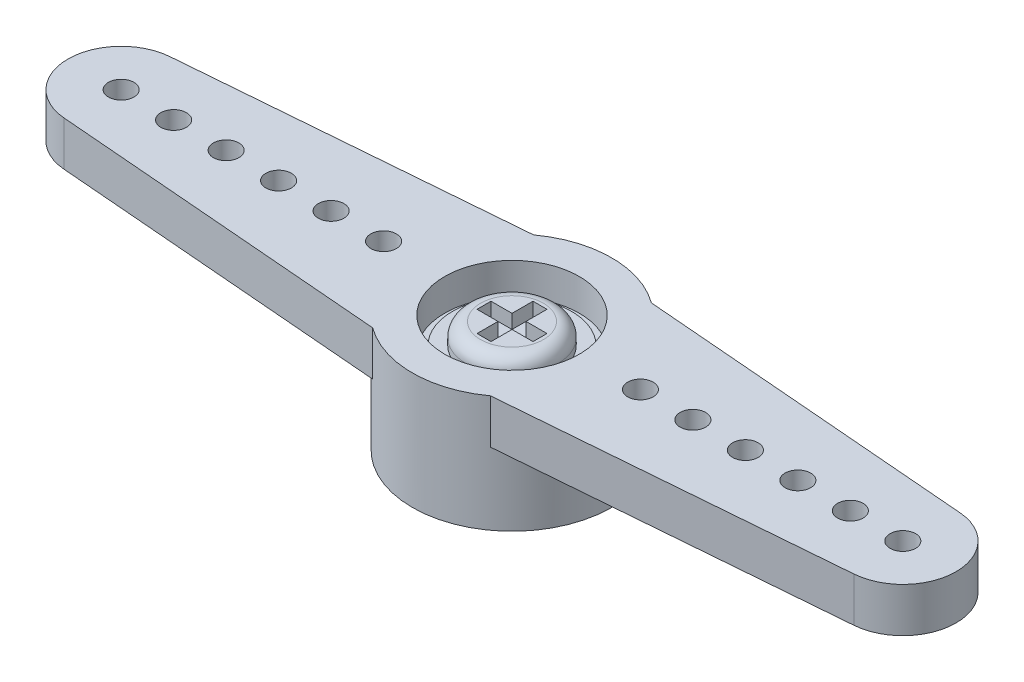
from build123d import *
from build123d.topology import SkipClean

# Parameters (mm, degrees)
EXTRUDE17_DEPTH = 1.6129
EXTRUDE19_START = -4.2291
SKETCH19_R      = 3.6195
EXTRUDE19_DEPTH = 4.2291
SKETCH20_R      = 0.46355
SKETCH20_R_2    = 1.27
EXTRUDE20_DEPTH = 18.050548166
SKETCH21_R      = 2.44475
EXTRUDE21_DEPTH = 1.1557
SKETCH22_R      = 2.286
EXTRUDE22_DEPTH = 2.3368
SKETCH23_R      = 2.159
EXTRUDE23_DEPTH = 0.2032
SKETCH24_R      = 1.651
EXTRUDE24_DEPTH = 0.762
EXTRUDE25_DEPTH = 0.508
FILLET1_R       = 0.508


with BuildPart() as part:
    # Sketch18 → Extrude17 (new body)
    with BuildSketch(Plane(origin=(0, 0, 0), x_dir=(1, 0, 0), z_dir=(0, 1, 0))):
        with BuildLine():
            Line((-14.34305969, 1.923991942), (-2.13741415, 2.921))
            ThreePointArc((-2.13741415, 2.921), (0, 3.6195), (2.13741415, 2.921))
            Line((2.13741415, 2.921), (14.34305969, 1.923991942))
            ThreePointArc((14.34305969, 1.923991942), (16.1163, 0), (14.34305969, -1.923991942))
            Line((14.34305969, -1.923991942), (2.13741415, -2.921))
            ThreePointArc((2.13741415, -2.921), (0, -3.6195), (-2.13741415, -2.921))
            Line((-2.13741415, -2.921), (-14.34305969, -1.923991942))
            ThreePointArc((-14.34305969, -1.923991942), (-16.1163, 0), (-14.34305969, 1.923991942))
        make_face()
    extrude(amount=EXTRUDE17_DEPTH)

    # Sketch19 → Extrude19 (add)
    with SkipClean():  # the faces are left unmerged after this step: merging them gives an invalid solid
        with BuildSketch(Plane(origin=(0, 1.6129, 0), x_dir=(1, 0, 0), z_dir=(0, 1, 0)).offset(EXTRUDE19_START)):
            with Locations(Location((0, 0, 0), (0, 0, 53.805552525))):
                Circle(SKETCH19_R)
        extrude(amount=EXTRUDE19_DEPTH)

    # Sketch20 → Extrude20 (cut, through all)
    with SkipClean():  # the faces are left unmerged after this step: merging them gives an invalid solid
        with BuildSketch(Plane(origin=(0, 1.6129, 0), x_dir=(1, 0, 0), z_dir=(0, 1, 0))):
            with Locations(Location((-14.1859, 0, 0), (0, 0, 270))):
                Circle(SKETCH20_R)
            with Locations(Location((0, 0, 0), (0, 0, 270))):
                Circle(SKETCH20_R_2)
            with Locations(Location((12.2809, 0, 0), (0, 0, 270))):
                Circle(SKETCH20_R)
            with Locations(Location((-4.6609, 0, 0), (0, 0, 270))):
                Circle(SKETCH20_R)
            with Locations(Location((-6.5659, 0, 0), (0, 0, 270))):
                Circle(SKETCH20_R)
            with Locations(Location((-8.4709, 0, 0), (0, 0, 270))):
                Circle(SKETCH20_R)
            with Locations(Location((-10.3759, 0, 0), (0, 0, 270))):
                Circle(SKETCH20_R)
            with Locations(Location((-12.2809, 0, 0), (0, 0, 270))):
                Circle(SKETCH20_R)
            with Locations(Location((10.3759, 0, 0), (0, 0, 270))):
                Circle(SKETCH20_R)
            with Locations(Location((8.4709, 0, 0), (0, 0, 270))):
                Circle(SKETCH20_R)
            with Locations(Location((6.5659, 0, 0), (0, 0, 270))):
                Circle(SKETCH20_R)
            with Locations(Location((4.6609, 0, 0), (0, 0, 270))):
                Circle(SKETCH20_R)
            with Locations(Location((14.1859, 0, 0), (0, 0, 270))):
                Circle(SKETCH20_R)
        extrude(amount=-EXTRUDE20_DEPTH, mode=Mode.SUBTRACT)

    # Sketch21 → Extrude21 (cut)
    with SkipClean():  # the faces are left unmerged after this step: merging them gives an invalid solid
        with BuildSketch(Plane(origin=(0, 1.6129, 0), x_dir=(1, 0, 0), z_dir=(0, 1, 0))):
            with Locations(Location((0, 0, 0), (0, 0, 270))):
                Circle(SKETCH21_R)
        extrude(amount=-EXTRUDE21_DEPTH, mode=Mode.SUBTRACT)

    # Sketch22 → Extrude22 (cut)
    with SkipClean():  # the faces are left unmerged after this step: merging them gives an invalid solid
        with BuildSketch(Plane.XZ.offset(2.6162)):
            with Locations(Location((0, 0, 0), (0, 0, 270))):
                Circle(SKETCH22_R)
        extrude(amount=-EXTRUDE22_DEPTH, mode=Mode.SUBTRACT)



with BuildPart() as body_2:
    # Sketch23 → Extrude23 (new body)
    with BuildSketch(Plane(origin=(0, 0.4572, 0), x_dir=(1, 0, 0), z_dir=(0, 1, 0))):
        with Locations(Location((0, 0, 0), (0, 0, 270))):
            Circle(SKETCH23_R)
    extrude(amount=EXTRUDE23_DEPTH)


with BuildPart() as part_1:
    with SkipClean():  # the faces are left unmerged after this step: merging them gives an invalid solid
        add(part.part)

        add(body_2.part)  # Extrude24 merges body 2
        # Sketch24 → Extrude24 (add)
        with BuildSketch(Plane(origin=(0, 0.6604, 0), x_dir=(1, 0, 0), z_dir=(0, 1, 0))):
            with Locations(Location((0, 0, 0), (0, 0, 90))):
                Circle(SKETCH24_R)
        extrude(amount=EXTRUDE24_DEPTH)

    # Sketch25 → Extrude25 (cut)
    with SkipClean():  # the faces are left unmerged after this step: merging them gives an invalid solid
        with BuildSketch(Plane(origin=(0, 1.4224, 0), x_dir=(1, 0, 0), z_dir=(0, 1, 0))):
            Polygon((0.254, -1.016), (-0.254, -1.016), (-0.254, -0.254), (-1.016, -0.254), (-1.016, 0.254), (-0.254, 0.254), (-0.254, 1.016), (0.254, 1.016), (0.254, 0.254), (1.016, 0.254), (1.016, -0.254), (0.254, -0.254), align=None)
        extrude(amount=-EXTRUDE25_DEPTH, mode=Mode.SUBTRACT)

    # Fillet1
    fillet1_edges = [part_1.edges().sort_by_distance(p)[0] for p in [
        (0, 1.4224, 1.651),
    ]]
    fillet(fillet1_edges, radius=FILLET1_R)


solid = part_1.part
